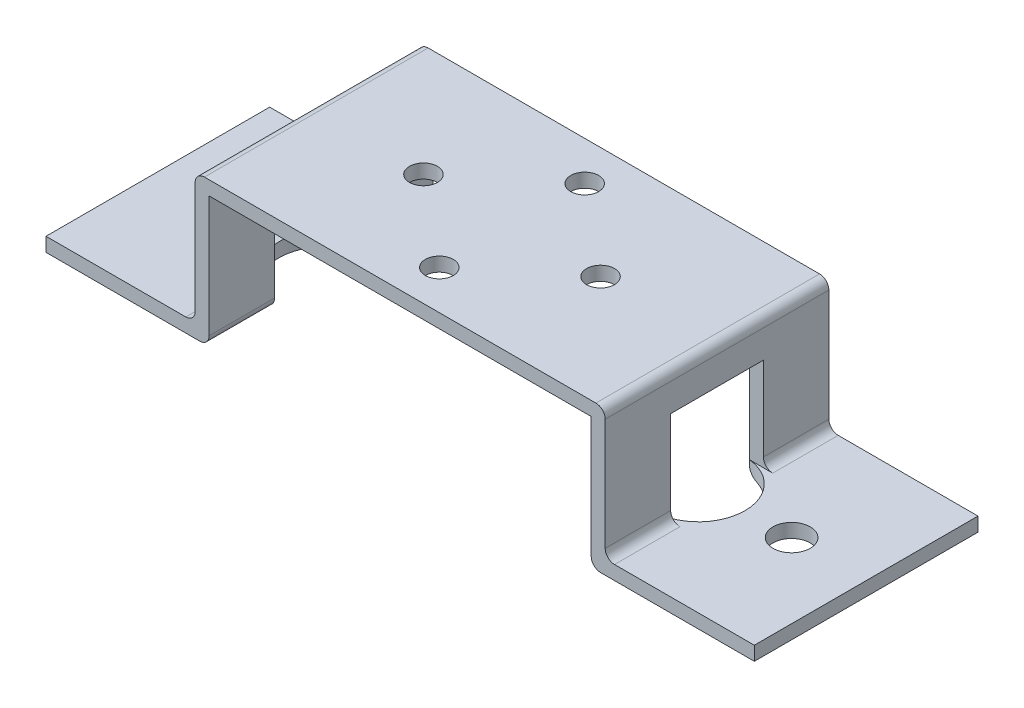
from build123d import *

# Parameters (mm, degrees)
BOSS_EXTRUDE2_DEPTH     = 24
CUT_EXTRUDE1_DEPTH      = 81.91971329657565
CUT_EXTRUDE1_DEPTH_BACK = 81.91971329657565
SKETCH17_R              = 1.9999999999999996
SKETCH17_R_2            = 1.9999999999999962
F_3_0MM_DOWEL_HOLE1_D   = 3
SKETCH22_R              = 5.000000000000001
SKETCH22_R_2            = 4.9999999999999964
CUT_EXTRUDE2_DEPTH      = 1.5
CUT_EXTRUDE3_DEPTH      = 67.45487190567748
CUT_EXTRUDE3_DEPTH_BACK = 67.45487190567748
SKETCH23_W              = 9.949874371066619
SKETCH23_H              = 10
FILLET1_R               = 1


with BuildPart() as part:
    # 3DSketch1 → Boss-Extrude2 (new body)
    with BuildSketch(Plane(origin=(0, 0, 0), x_dir=(0.9998052854172774, 0.01973299905428837, 0), z_dir=(0, -2.14e-15, 1))):
        Polygon((0, 0), (17.496592494802357, -0.34532748345004655), (17.772854481562394, 13.65194651239183), (58.76487118367076, 12.842893551166007), (58.48860919691073, -1.1543804446758696), (75.98520169171307, -1.499707928125916), (76.0148011902945, 2.2e-16), (60.01791662361808, 0.315727984868614), (60.29417861037812, 14.313001980710496), (16.302746052017905, 15.181253939099182), (16.02648406525787, 1.1839799432573024), (0.02959949858143255, 1.4997079281259162), align=None)
    extrude(amount=BOSS_EXTRUDE2_DEPTH)

    # Sketch17 → Cut-Extrude1 (cut, two sides: drawn at the far end of the back side and taken through both)
    with BuildSketch(Plane(origin=(0, 1.5, 0), x_dir=(1, 0, 0), z_dir=(0, 1, 0)).offset(-CUT_EXTRUDE1_DEPTH_BACK)):
        with Locations(Location((8, -12.000000000000002, 0), (0, 0, 270))):
            Circle(SKETCH17_R)
        with Locations(Location((68, -12.000000000000002, 0), (0, 0, 270))):
            Circle(SKETCH17_R_2)
    extrude(amount=CUT_EXTRUDE1_DEPTH + CUT_EXTRUDE1_DEPTH_BACK, mode=Mode.SUBTRACT)

    # Ø3.0mm Dowel Hole1 (through all)
    with Locations(Plane(origin=(-6.1e-16, 15.499999999999996, 0), x_dir=(1, 0, 0), z_dir=(0, 1, 0))):
        with Locations((28.5, -12), (47.5, -12), (38, -19.8), (38, -4.2)):
            Hole(F_3_0MM_DOWEL_HOLE1_D / 2)

    # Sketch22 → Cut-Extrude2 (cut)
    with BuildSketch(Plane(origin=(0, 1.5, 0), x_dir=(1, 0, 0), z_dir=(0, 1, 0))):
        with Locations((17.999999999997943, -12.000000000000927)):
            Circle(SKETCH22_R)
        with Locations((58.00000000000207, -12.000000000000927)):
            Circle(SKETCH22_R_2)
    extrude(amount=-CUT_EXTRUDE2_DEPTH, mode=Mode.SUBTRACT)

    # Sketch23 → Cut-Extrude3 (cut, two sides: drawn at the far end of the back side and taken through both)
    with BuildSketch(Plane.ZY.offset(-16).offset(-CUT_EXTRUDE3_DEPTH_BACK)):
        with Locations((12.000000000000927, 6.5)):
            Rectangle(SKETCH23_W, SKETCH23_H)
    extrude(amount=CUT_EXTRUDE3_DEPTH + CUT_EXTRUDE3_DEPTH_BACK, mode=Mode.SUBTRACT)

    # Fillet1
    fillet1_edges = [part.edges().sort_by_distance(p)[0] for p in [
        (17.500000000000004, -7.53e-15, 3.5125314072338187),
        (17.500000000000004, -4.389e-14, 20.487468592767108),
        (58.50000000000001, -7.53e-15, 3.5125314072338205),
        (58.50000000000001, -4.389e-14, 20.487468592767108),
        (16, 15.499999999999973, 12.000000000000034),
        (60.000000000000014, 15.499999999999975, 12.000000000000034),
        (60.00000000000001, 1.499999999999956, 20.48746859276712),
        (60.00000000000001, 1.4999999999999925, 3.512531407233811),
        (15.999999999999998, 1.4999999999999565, 20.48746859276712),
        (15.999999999999998, 1.499999999999993, 3.5125314072338107),
    ]]
    fillet(fillet1_edges, radius=FILLET1_R)


solid = part.part
